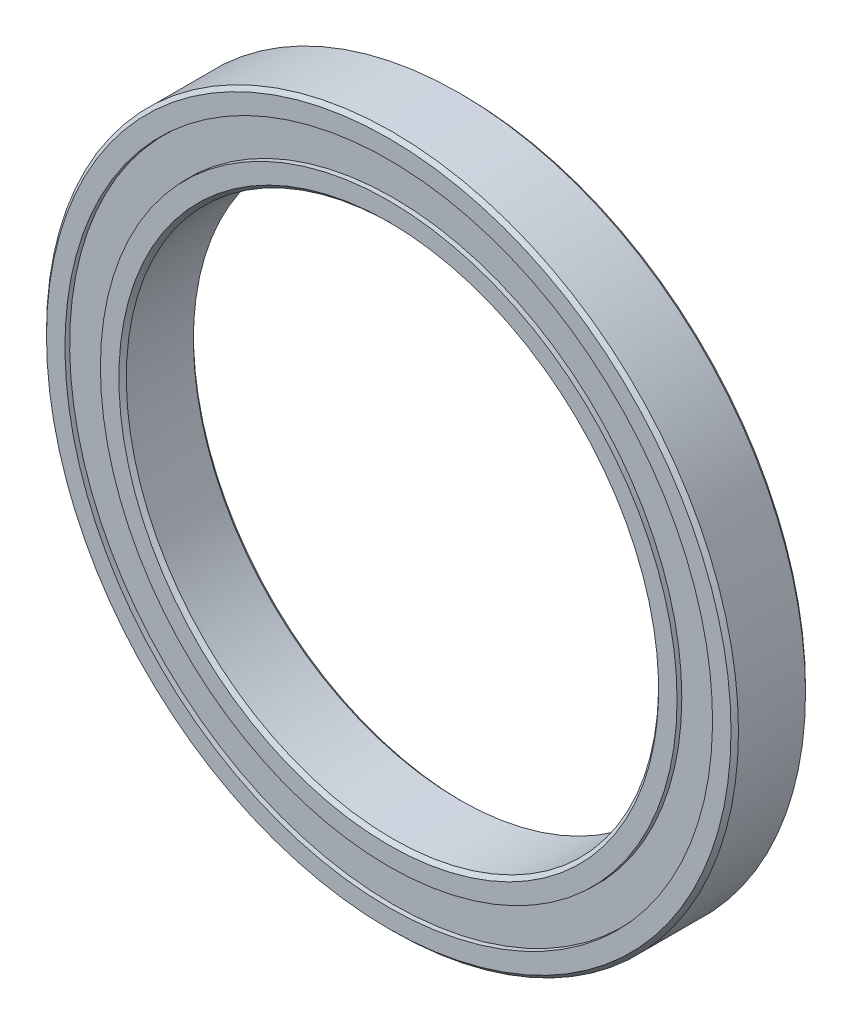
from build123d import *

# Parameters (mm, degrees)
SKETCH5_W         = 0.381
SKETCH5_H         = 3.282533334
CIRPATTERN1_COUNT = 23


with BuildPart() as part:
    # Sketch5 → Revolve1 (revolve)
    with BuildSketch(Plane(origin=(0, 0, 0), x_dir=(0, 0, -1), z_dir=(1, 0, 0)), mode=Mode.PRIVATE) as revolve1_sk:
        with BuildLine():
            Line((3.15, 32.5), (-3.15, 32.5))
            Line((-3.15, 32.5), (-3.5, 32.15))
            Line((-3.5, 32.15), (-3.5, 30.416666667))
            Line((-3.5, 30.416666667), (-1.555555556, 30.416666667))
            ThreePointArc((-1.555555556, 30.416666667), (0, 31.029809392), (1.555555556, 30.416666667))
            Line((1.555555556, 30.416666667), (3.5, 30.416666667))
            Line((3.5, 30.416666667), (3.5, 32.15))
            Line((3.5, 32.15), (3.15, 32.5))
        make_face()
        with Locations((2.889904696, 28.75)):
            Rectangle(SKETCH5_W, SKETCH5_H)
        with Locations((-2.889904696, 28.75)):
            Rectangle(SKETCH5_W, SKETCH5_H)
    revolve(revolve1_sk.sketch.rotate(Axis((0, 0, 3.5), (0, 0, -1)), 180), axis=Axis((0, 0, 3.5), (0, 0, -1)))


with BuildPart() as body_2:
    # Sketch3 → Revolve3 (revolve)
    with BuildSketch(Plane(origin=(0, 0, 0), x_dir=(0, 0, -1), z_dir=(1, 0, 0)), mode=Mode.PRIVATE) as revolve3_sk:
        with BuildLine():
            Line((-3.5, 27.083333333), (-1.555555556, 27.083333333))
            ThreePointArc((-1.555555556, 27.083333333), (0, 26.470190608), (1.555555556, 27.083333333))
            Line((1.555555556, 27.083333333), (3.5, 27.083333333))
            Line((3.5, 27.083333333), (3.5, 25.35))
            Line((3.5, 25.35), (3.15, 25))
            Line((3.15, 25), (-3.15, 25))
            Line((-3.15, 25), (-3.5, 25.35))
            Line((-3.5, 25.35), (-3.5, 27.083333333))
        make_face()
    revolve(revolve3_sk.sketch.rotate(Axis((0, 0, 3.5), (0, 0, -1)), 180), axis=Axis((0, 0, 3.5), (0, 0, -1)))


with BuildPart() as body_3:
    # Sketch4 → Revolve4 (revolve)
    with BuildSketch(Plane(origin=(0, 0, 0), x_dir=(0, 0, -1), z_dir=(1, 0, 0))):
        with BuildLine():
            Line((-2.279809392, 28.75), (2.279809392, 28.75))
            ThreePointArc((2.279809392, 28.75), (0, 31.029809392), (-2.279809392, 28.75))
        make_face()
    revolve(axis=Axis((0, 28.75, 2.279809392), (0, 0, -1)))


with BuildPart() as cirpattern1_1:
    # CirPattern1: pattern copy
    add(body_3.part.rotate(Axis((0, 0, 0), (0, 0, 1)), 1 * 360 / CIRPATTERN1_COUNT))


with BuildPart() as cirpattern1_2:
    # CirPattern1: pattern copy
    add(body_3.part.rotate(Axis((0, 0, 0), (0, 0, 1)), 2 * 360 / CIRPATTERN1_COUNT))


with BuildPart() as cirpattern1_3:
    # CirPattern1: pattern copy
    add(body_3.part.rotate(Axis((0, 0, 0), (0, 0, 1)), 3 * 360 / CIRPATTERN1_COUNT))


with BuildPart() as cirpattern1_4:
    # CirPattern1: pattern copy
    add(body_3.part.rotate(Axis((0, 0, 0), (0, 0, 1)), 4 * 360 / CIRPATTERN1_COUNT))


with BuildPart() as cirpattern1_5:
    # CirPattern1: pattern copy
    add(body_3.part.rotate(Axis((0, 0, 0), (0, 0, 1)), 5 * 360 / CIRPATTERN1_COUNT))


with BuildPart() as cirpattern1_6:
    # CirPattern1: pattern copy
    add(body_3.part.rotate(Axis((0, 0, 0), (0, 0, 1)), 6 * 360 / CIRPATTERN1_COUNT))


with BuildPart() as cirpattern1_7:
    # CirPattern1: pattern copy
    add(body_3.part.rotate(Axis((0, 0, 0), (0, 0, 1)), 7 * 360 / CIRPATTERN1_COUNT))


with BuildPart() as cirpattern1_8:
    # CirPattern1: pattern copy
    add(body_3.part.rotate(Axis((0, 0, 0), (0, 0, 1)), 8 * 360 / CIRPATTERN1_COUNT))


with BuildPart() as cirpattern1_9:
    # CirPattern1: pattern copy
    add(body_3.part.rotate(Axis((0, 0, 0), (0, 0, 1)), 9 * 360 / CIRPATTERN1_COUNT))


with BuildPart() as cirpattern1_10:
    # CirPattern1: pattern copy
    add(body_3.part.rotate(Axis((0, 0, 0), (0, 0, 1)), 10 * 360 / CIRPATTERN1_COUNT))


with BuildPart() as cirpattern1_11:
    # CirPattern1: pattern copy
    add(body_3.part.rotate(Axis((0, 0, 0), (0, 0, 1)), 11 * 360 / CIRPATTERN1_COUNT))


with BuildPart() as cirpattern1_12:
    # CirPattern1: pattern copy
    add(body_3.part.rotate(Axis((0, 0, 0), (0, 0, 1)), 12 * 360 / CIRPATTERN1_COUNT))


with BuildPart() as cirpattern1_13:
    # CirPattern1: pattern copy
    add(body_3.part.rotate(Axis((0, 0, 0), (0, 0, 1)), 13 * 360 / CIRPATTERN1_COUNT))


with BuildPart() as cirpattern1_14:
    # CirPattern1: pattern copy
    add(body_3.part.rotate(Axis((0, 0, 0), (0, 0, 1)), 14 * 360 / CIRPATTERN1_COUNT))


with BuildPart() as cirpattern1_15:
    # CirPattern1: pattern copy
    add(body_3.part.rotate(Axis((0, 0, 0), (0, 0, 1)), 15 * 360 / CIRPATTERN1_COUNT))


with BuildPart() as cirpattern1_16:
    # CirPattern1: pattern copy
    add(body_3.part.rotate(Axis((0, 0, 0), (0, 0, 1)), 16 * 360 / CIRPATTERN1_COUNT))


with BuildPart() as cirpattern1_17:
    # CirPattern1: pattern copy
    add(body_3.part.rotate(Axis((0, 0, 0), (0, 0, 1)), 17 * 360 / CIRPATTERN1_COUNT))


with BuildPart() as cirpattern1_18:
    # CirPattern1: pattern copy
    add(body_3.part.rotate(Axis((0, 0, 0), (0, 0, 1)), 18 * 360 / CIRPATTERN1_COUNT))


with BuildPart() as cirpattern1_19:
    # CirPattern1: pattern copy
    add(body_3.part.rotate(Axis((0, 0, 0), (0, 0, 1)), 19 * 360 / CIRPATTERN1_COUNT))


with BuildPart() as cirpattern1_20:
    # CirPattern1: pattern copy
    add(body_3.part.rotate(Axis((0, 0, 0), (0, 0, 1)), 20 * 360 / CIRPATTERN1_COUNT))


with BuildPart() as cirpattern1_21:
    # CirPattern1: pattern copy
    add(body_3.part.rotate(Axis((0, 0, 0), (0, 0, 1)), 21 * 360 / CIRPATTERN1_COUNT))


with BuildPart() as cirpattern1_22:
    # CirPattern1: pattern copy
    add(body_3.part.rotate(Axis((0, 0, 0), (0, 0, 1)), 22 * 360 / CIRPATTERN1_COUNT))


solid = Compound([part.part, body_2.part, body_3.part, cirpattern1_1.part, cirpattern1_2.part, cirpattern1_3.part, cirpattern1_4.part, cirpattern1_5.part, cirpattern1_6.part, cirpattern1_7.part, cirpattern1_8.part, cirpattern1_9.part, cirpattern1_10.part, cirpattern1_11.part, cirpattern1_12.part, cirpattern1_13.part, cirpattern1_14.part, cirpattern1_15.part, cirpattern1_16.part, cirpattern1_17.part, cirpattern1_18.part, cirpattern1_19.part, cirpattern1_20.part, cirpattern1_21.part, cirpattern1_22.part])
